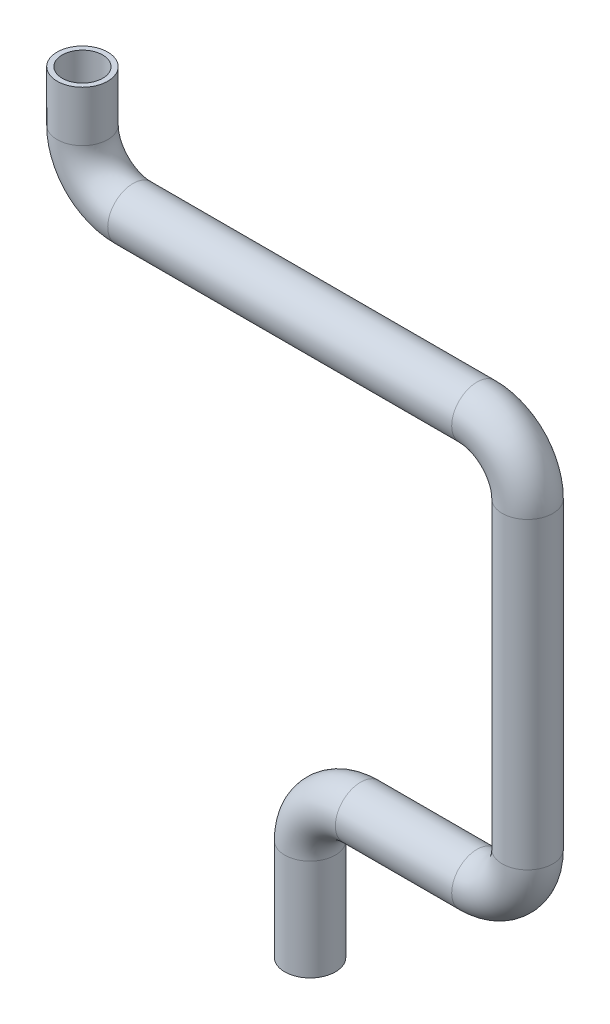
from build123d import *

# Parameters (mm, degrees)
SWEEP_1_PROFILE_R   = 5
SWEEP_1_2_PROFILE_R = 4


with BuildPart() as part:
    # Sweep 1: sweep along a path in 草图1
    with BuildLine(Plane.XY) as sweep_1_path:
        Line((0, 0), (0, 20))
        ThreePointArc((0, 20), (2.928932188, 27.071067812), (10, 30))
        Line((10, 30), (33, 30))
        ThreePointArc((33, 30), (40.071067812, 32.928932188), (43, 40))
        Line((43, 40), (43, 100))
        ThreePointArc((43, 100), (40.071067812, 107.071067812), (33, 110))
        Line((33, 110), (-35, 110))
        ThreePointArc((-35, 110), (-42.071067812, 112.928932188), (-45, 120))
        Line((-45, 120), (-45, 130))
    # Sweep 1 profile (on start of the path) → Sweep 1 (sweep)
    with BuildSketch(Plane.ZX):
        Circle(SWEEP_1_PROFILE_R)
    sweep(path=sweep_1_path.line)

    # Sweep 1 2: sweep along a path in 草图7
    with BuildLine(Plane.XY) as sweep_1_2_path:
        Line((0, 0), (0, 20))
        ThreePointArc((0, 20), (2.928932188, 27.071067812), (10, 30))
        Line((10, 30), (33, 30))
        ThreePointArc((33, 30), (40.071067812, 32.928932188), (43, 40))
        Line((43, 40), (43, 100))
        ThreePointArc((43, 100), (40.071067812, 107.071067812), (33, 110))
        Line((33, 110), (-35, 110))
        ThreePointArc((-35, 110), (-42.071067812, 112.928932188), (-45, 120))
        Line((-45, 120), (-45, 130))
    # Sweep 1 2 profile (on start of the path) → Sweep 1 2 (sweep, cut)
    with BuildSketch(Plane(origin=(0, 0, 0), x_dir=(1, 0, 0), z_dir=(0, 1, 0))):
        Circle(SWEEP_1_2_PROFILE_R)
    sweep(path=sweep_1_2_path.line, mode=Mode.SUBTRACT)


solid = part.part
